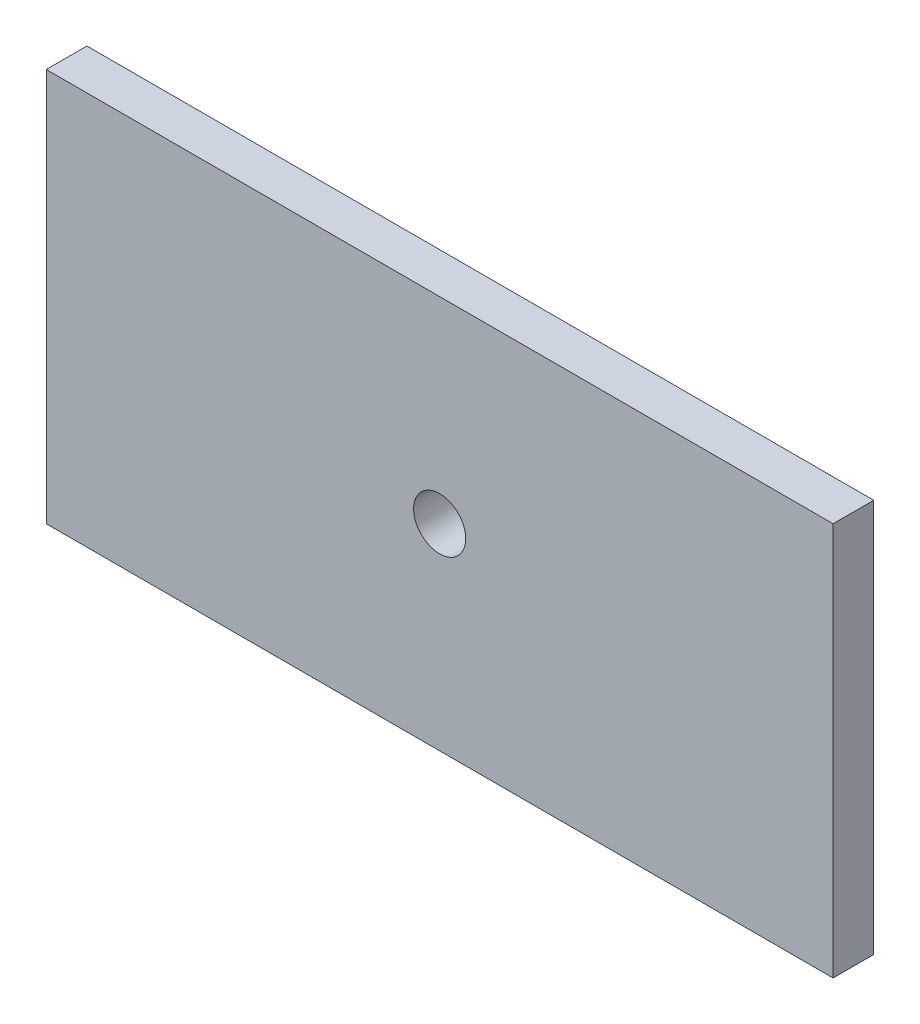
from build123d import *

# Parameters (mm, degrees)
SKETCH1_W           = 152.4
SKETCH1_H           = 76.2
BOSS_EXTRUDE1_DEPTH = 7.874
SKETCH2_R           = 5.05000006
CUT_EXTRUDE1_DEPTH  = 7.874


with BuildPart() as part:
    # Sketch1 → Boss-Extrude1 (new body)
    with BuildSketch(Plane.XY):
        Rectangle(SKETCH1_W, SKETCH1_H)
    extrude(amount=-BOSS_EXTRUDE1_DEPTH)

    # Sketch2 → Cut-Extrude1 (cut)
    with BuildSketch(Plane.XY):
        Circle(SKETCH2_R)
    extrude(amount=-CUT_EXTRUDE1_DEPTH, mode=Mode.SUBTRACT)


solid = part.part
